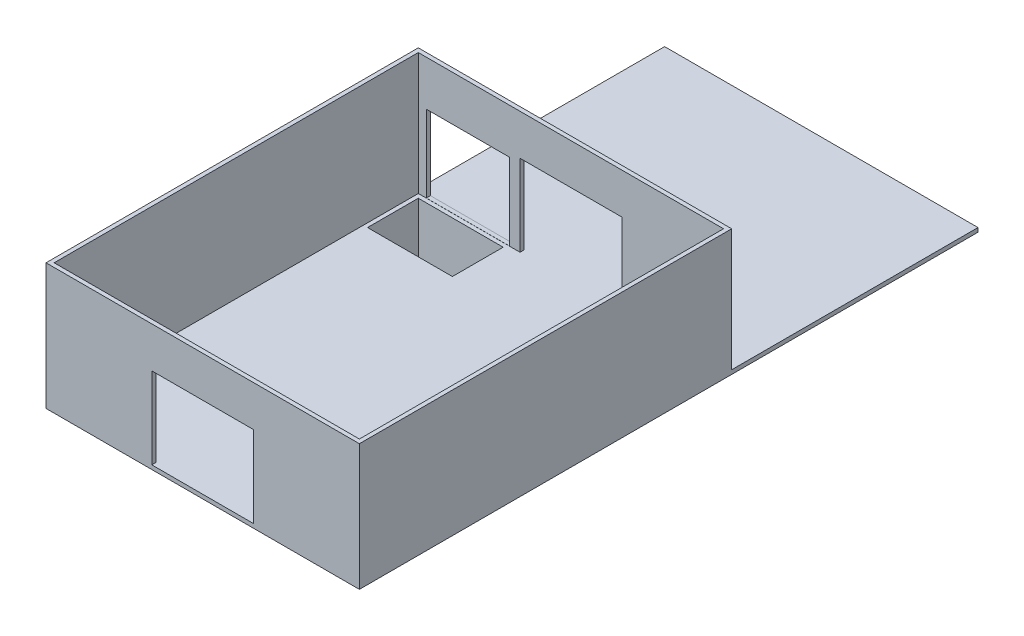
from build123d import *

# Parameters (mm, degrees)
CROQUIS2_W              = 15400
CROQUIS2_H              = 30400
CROQUIS2_W_2            = 15000
CROQUIS2_H_2            = 30000
CROQUIS2_H_3            = 200
SALIENTE_EXTRUIR1_DEPTH = 6000
CROQUIS2_2_W            = 15400
CROQUIS2_2_H            = 30400
CROQUIS2_2_W_2          = 15000
CROQUIS2_2_H_2          = 30000
CROQUIS2_2_H_3          = 11904.574403382
CROQUIS2_2_H_4          = 17895.425596618
CROQUIS2_2_H_5          = 200
SALIENTE_EXTRUIR2_DEPTH = 200
CROQUIS5_W              = 5000
CROQUIS5_H              = 4000
CORTAR_EXTRUIR1_DEPTH   = 31929.827100287
CROQUIS6_W              = 4570.193925868
CROQUIS6_H              = 2895.425596618
CROQUIS6_W_2            = 4170.193925868
CROQUIS6_H_2            = 2495.425596618
CORTAR_EXTRUIR2_DEPTH   = 18065.606278577
CROQUIS6_3_W            = 4570.193925868
CROQUIS6_3_H            = 2895.425596618
CROQUIS6_3_W_2          = 4170.193925868
CROQUIS6_3_H_2          = 2495.425596618
SALIENTE_EXTRUIR3_DEPTH = 2831
SALIENTE_EXTRUIR4_START = -2831
CROQUIS6_5_W            = 4570.193925868
CROQUIS6_5_H            = 2895.425596618
SALIENTE_EXTRUIR4_DEPTH = 200
CROQUIS7_W              = 4095.045838221
CROQUIS7_H              = 3780.908255671
CORTAR_EXTRUIR3_DEPTH   = 562
CROQUIS8_W              = 25320.425141551
CROQUIS8_H              = 14574.739237939
CORTAR_EXTRUIR4_DEPTH   = 19500


with BuildPart() as part:
    # Croquis2 → Saliente-Extruir1 (new body)
    # profile 1 of 2: a face of its own
    with BuildSketch(Plane(origin=(0, 0, 0), x_dir=(1, 0, 0), z_dir=(0, 1, 0))):
        Rectangle(CROQUIS2_W, CROQUIS2_H)
        Rectangle(CROQUIS2_W_2, CROQUIS2_H_2, mode=Mode.SUBTRACT)
    # profile 2 of 2: a face of its own
    with BuildSketch(Plane(origin=(0, 0, 0), x_dir=(1, 0, 0), z_dir=(0, 1, 0))):
        with Locations((0, 2995.425596618)):
            Rectangle(CROQUIS2_W_2, CROQUIS2_H_3)
    extrude(amount=SALIENTE_EXTRUIR1_DEPTH)

    # Croquis2<2> → Saliente-Extruir2 (add)
    # profile 1 of 4: a face of its own
    with BuildSketch(Plane(origin=(0, 0, 0), x_dir=(1, 0, 0), z_dir=(0, 1, 0))):
        Rectangle(CROQUIS2_2_W, CROQUIS2_2_H)
        Rectangle(CROQUIS2_2_W_2, CROQUIS2_2_H_2, mode=Mode.SUBTRACT)
    # profile 2 of 4: a face of its own
    with BuildSketch(Plane(origin=(0, 0, 0), x_dir=(1, 0, 0), z_dir=(0, 1, 0))):
        with Locations((0, 9047.712798309)):
            Rectangle(CROQUIS2_2_W_2, CROQUIS2_2_H_3)
    # profile 3 of 4: a face of its own
    with BuildSketch(Plane(origin=(0, 0, 0), x_dir=(1, 0, 0), z_dir=(0, 1, 0))):
        with Locations((0, -6052.287201691)):
            Rectangle(CROQUIS2_2_W_2, CROQUIS2_2_H_4)
    # profile 4 of 4: a face of its own
    with BuildSketch(Plane(origin=(0, 0, 0), x_dir=(1, 0, 0), z_dir=(0, 1, 0))):
        with Locations((0, 2995.425596618)):
            Rectangle(CROQUIS2_2_W_2, CROQUIS2_2_H_5)
    extrude(amount=-SALIENTE_EXTRUIR2_DEPTH)

    # Croquis5 → Cortar-Extruir1 (cut, through all)
    with BuildSketch(Plane.XY.offset(15200)):
        with Locations((0, 2000)):
            Rectangle(CROQUIS5_W, CROQUIS5_H)
    extrude(amount=-CORTAR_EXTRUIR1_DEPTH, mode=Mode.SUBTRACT)

    # Croquis6 → Cortar-Extruir2 (cut, through all)
    with BuildSketch(Plane(origin=(0, 0, 0), x_dir=(1, 0, 0), z_dir=(0, 1, 0))):
        with Locations((-5214.903037066, 1447.712798309)):
            Rectangle(CROQUIS6_W, CROQUIS6_H)
        with Locations((-5214.903037066, 1447.712798309)):
            Rectangle(CROQUIS6_W_2, CROQUIS6_H_2, mode=Mode.SUBTRACT)
    extrude(amount=-CORTAR_EXTRUIR2_DEPTH, mode=Mode.SUBTRACT)


with BuildPart() as cortar_extruir2_kept_piece:
    # of the separate pieces the step leaves, the one the design keeps (cortar_extruir2_pieces_kept)
    add(part.part.solids().sort_by_distance((-7700, 6000, -15200))[0])

    # Croquis6<3> → Saliente-Extruir3 (add)
    with BuildSketch(Plane(origin=(0, 0, 0), x_dir=(1, 0, 0), z_dir=(0, 1, 0))):
        with Locations((-5214.903037066, 1447.712798309)):
            Rectangle(CROQUIS6_3_W, CROQUIS6_3_H)
        with Locations((-5214.903037066, 1447.712798309)):
            Rectangle(CROQUIS6_3_W_2, CROQUIS6_3_H_2, mode=Mode.SUBTRACT)
    extrude(amount=-SALIENTE_EXTRUIR3_DEPTH)

    # Croquis6<5> → Saliente-Extruir4 (add)
    with BuildSketch(Plane(origin=(0, 0, 0), x_dir=(1, 0, 0), z_dir=(0, 1, 0)).offset(SALIENTE_EXTRUIR4_START)):
        with Locations((-5214.903037066, 1447.712798309)):
            Rectangle(CROQUIS6_5_W, CROQUIS6_5_H)
    extrude(amount=-SALIENTE_EXTRUIR4_DEPTH)

    # Croquis7 → Cortar-Extruir3 (cut)
    with BuildSketch(Plane.XY.offset(-2895.425596618)):
        with Locations((-5060.611397561, 1896.366414305)):
            Rectangle(CROQUIS7_W, CROQUIS7_H)
    extrude(amount=-CORTAR_EXTRUIR3_DEPTH, mode=Mode.SUBTRACT)

    # Croquis8 → Cortar-Extruir4 (cut)
    with BuildSketch(Plane(origin=(0, 0, 0), x_dir=(1, 0, 0), z_dir=(0, 1, 0))):
        with Locations((1266.213821781, 10382.795215588)):
            Rectangle(CROQUIS8_W, CROQUIS8_H)
    extrude(amount=CORTAR_EXTRUIR4_DEPTH, mode=Mode.SUBTRACT)


solid = cortar_extruir2_kept_piece.part
